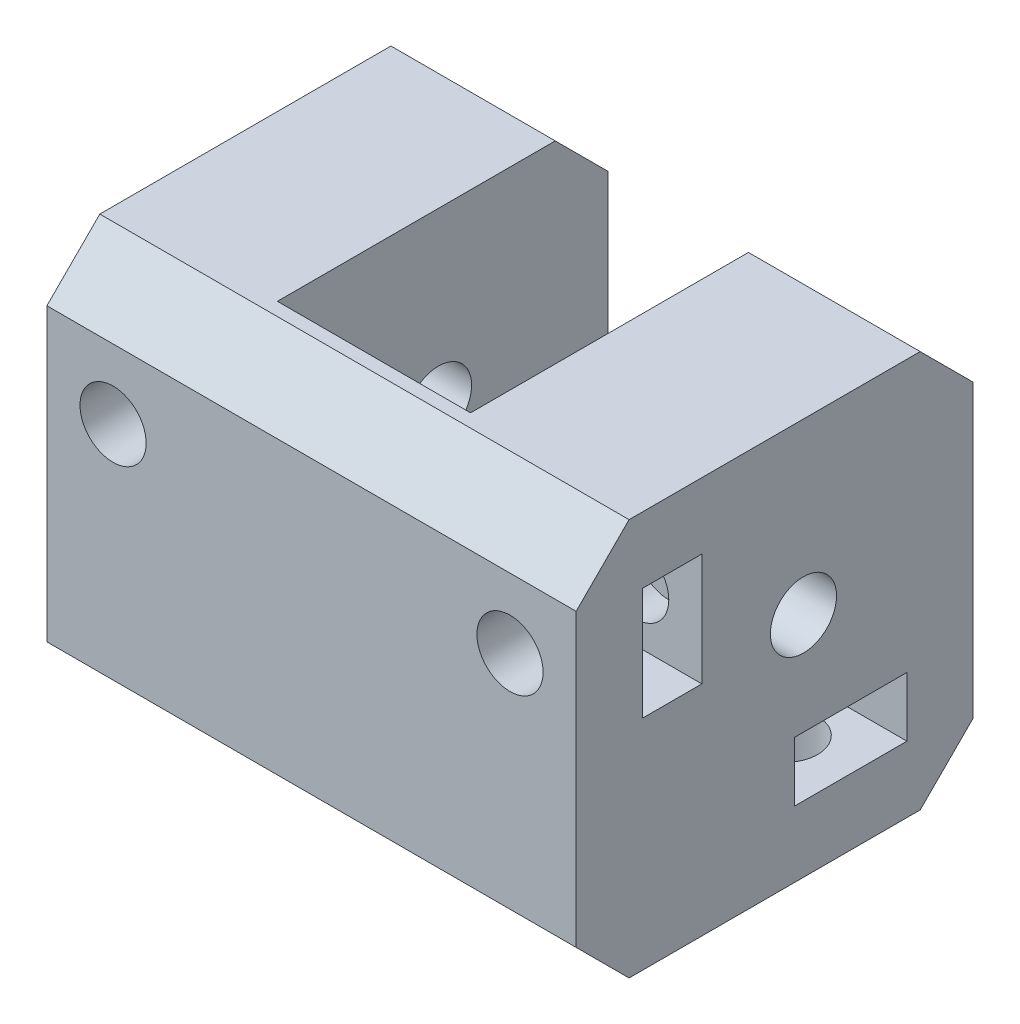
from build123d import *

# Parameters (mm, degrees)
SKETCH1_W           = 39.999999999
SKETCH1_H           = 30
BOSS_EXTRUDE1_DEPTH = 30
SKETCH2_W           = 14.6
SKETCH2_H           = 33.728920846
CUT_EXTRUDE1_DEPTH  = 25
SKETCH3_R           = 2.5
CUT_EXTRUDE2_DEPTH  = 77.38910698
SKETCH4_W           = 8.5
SKETCH4_H           = 4.5
SKETCH4_W_2         = 4.5
SKETCH4_H_2         = 8.5
CUT_EXTRUDE3_DEPTH  = 9
CUT_EXTRUDE4_START  = -40
SKETCH4_2_W         = 8.5
SKETCH4_2_H         = 4.5
SKETCH4_2_W_2       = 4.5
SKETCH4_2_H_2       = 8.5
CUT_EXTRUDE4_DEPTH  = 9
SKETCH5_R           = 2.5
CUT_EXTRUDE5_DEPTH  = 12
CHAMFER1_SIZE       = 4


with BuildPart() as part:
    # Sketch1 → Boss-Extrude1 (new body)
    with BuildSketch(Plane.XY):
        with Locations((-51.592932584, 42.752018711)):
            Rectangle(SKETCH1_W, SKETCH1_H)
    extrude(amount=BOSS_EXTRUDE1_DEPTH)

    # Sketch2 → Cut-Extrude1 (cut)
    with BuildSketch(Plane(origin=(0, 57.752018711, 0), x_dir=(1, 0, 0), z_dir=(0, 1, 0))):
        with Locations((-51.872932582, -8.135539577)):
            Rectangle(SKETCH2_W, SKETCH2_H)
    extrude(amount=-CUT_EXTRUDE1_DEPTH, mode=Mode.SUBTRACT)

    # Sketch3 → Cut-Extrude2 (cut, through all)
    with BuildSketch(Plane(origin=(-31.592932584, 0, 0), x_dir=(0, 0, -1), z_dir=(1, 0, 0))):
        with Locations((-12.822072937, 44.929945774)):
            Circle(SKETCH3_R)
    extrude(amount=-CUT_EXTRUDE2_DEPTH, mode=Mode.SUBTRACT)

    # Sketch4 → Cut-Extrude3 (cut)
    with BuildSketch(Plane(origin=(-31.592932584, 0, 0), x_dir=(0, 0, -1), z_dir=(1, 0, 0))):
        with Locations((-9.25, 35.002018711)):
            Rectangle(SKETCH4_W, SKETCH4_H)
        with Locations((-22.75, 48.502018711)):
            Rectangle(SKETCH4_W_2, SKETCH4_H_2)
    extrude(amount=-CUT_EXTRUDE3_DEPTH, mode=Mode.SUBTRACT)

    # Sketch4<2> → Cut-Extrude4 (cut)
    with BuildSketch(Plane(origin=(-31.592932584, 0, 0), x_dir=(0, 0, -1), z_dir=(1, 0, 0)).offset(CUT_EXTRUDE4_START)):
        with Locations((-9.25, 35.002018711)):
            Rectangle(SKETCH4_2_W, SKETCH4_2_H)
        with Locations((-22.75, 48.502018711)):
            Rectangle(SKETCH4_2_W_2, SKETCH4_2_H_2)
    extrude(amount=CUT_EXTRUDE4_DEPTH, mode=Mode.SUBTRACT)

    # Sketch5 → Cut-Extrude5 (cut)
    with BuildSketch(Plane.XY.offset(30)):
        with Locations((-66.592932583, 48.502018711)):
            Circle(SKETCH5_R)
        with Locations((-36.592932584, 48.502018711)):
            Circle(SKETCH5_R)
    cut_extrude5 = extrude(amount=-CUT_EXTRUDE5_DEPTH, mode=Mode.SUBTRACT)

    # Mirror1: Cut-Extrude5 across plane
    add(cut_extrude5.mirror(Plane(origin=(0, 28.876009355, 28.876009355), x_dir=(0, -0.7071067811865478, 0.7071067811865472), z_dir=(0, -0.7071067811865475, -0.7071067811865477))), mode=Mode.SUBTRACT)

    # Chamfer1
    chamfer1_edges = [part.edges().sort_by_distance(p)[0] for p in [
        (-51.592932584, 27.752018711, 30),
        (-65.382932583, 57.752018711, 0),
        (-51.592932584, 27.752018711, 0),
        (-38.082932583, 57.752018711, 0),
        (-51.592932584, 57.752018711, 30),
    ]]
    chamfer(chamfer1_edges, length=CHAMFER1_SIZE)


solid = part.part
